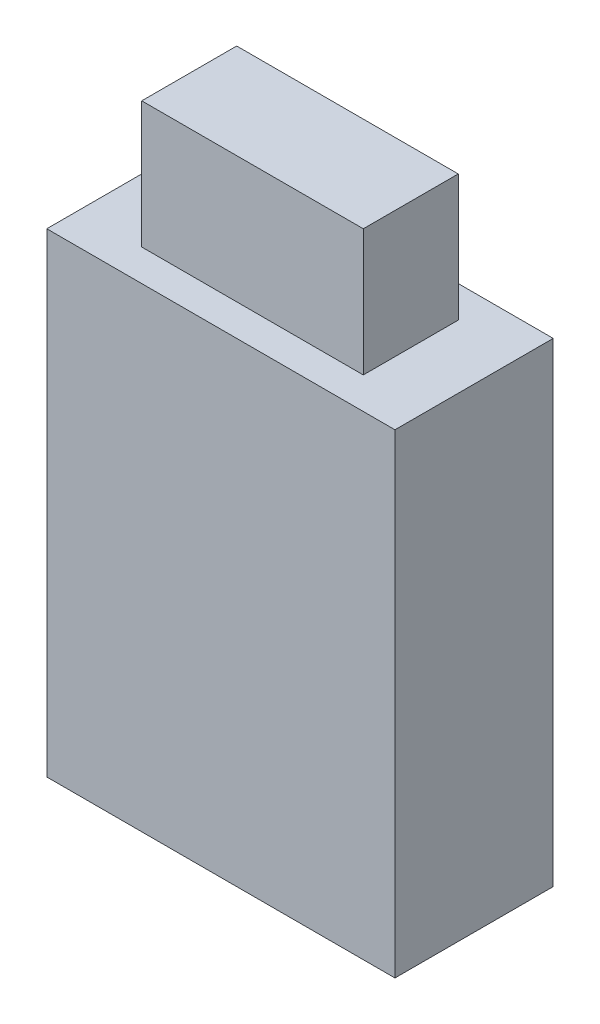
from build123d import *

# Parameters (mm, degrees)
BOSS_EXTRUDE1_START = 56
SKETCH1_W           = 22
SKETCH1_H           = 30
BOSS_EXTRUDE1_DEPTH = 10
BOSS_EXTRUDE2_START = 58
SKETCH2_W           = 14
SKETCH2_H           = 8
BOSS_EXTRUDE2_DEPTH = 6


with BuildPart() as part:
    # Sketch1 → Boss-Extrude1 (new body)
    with BuildSketch(Plane.XY.offset(BOSS_EXTRUDE1_START)):
        with Locations((-41, 173)):
            Rectangle(SKETCH1_W, SKETCH1_H)
    extrude(amount=BOSS_EXTRUDE1_DEPTH)

    # Sketch2 → Boss-Extrude2 (add)
    with BuildSketch(Plane.XY.offset(BOSS_EXTRUDE2_START)):
        with Locations((-41, 192)):
            Rectangle(SKETCH2_W, SKETCH2_H)
    extrude(amount=BOSS_EXTRUDE2_DEPTH)


solid = part.part
